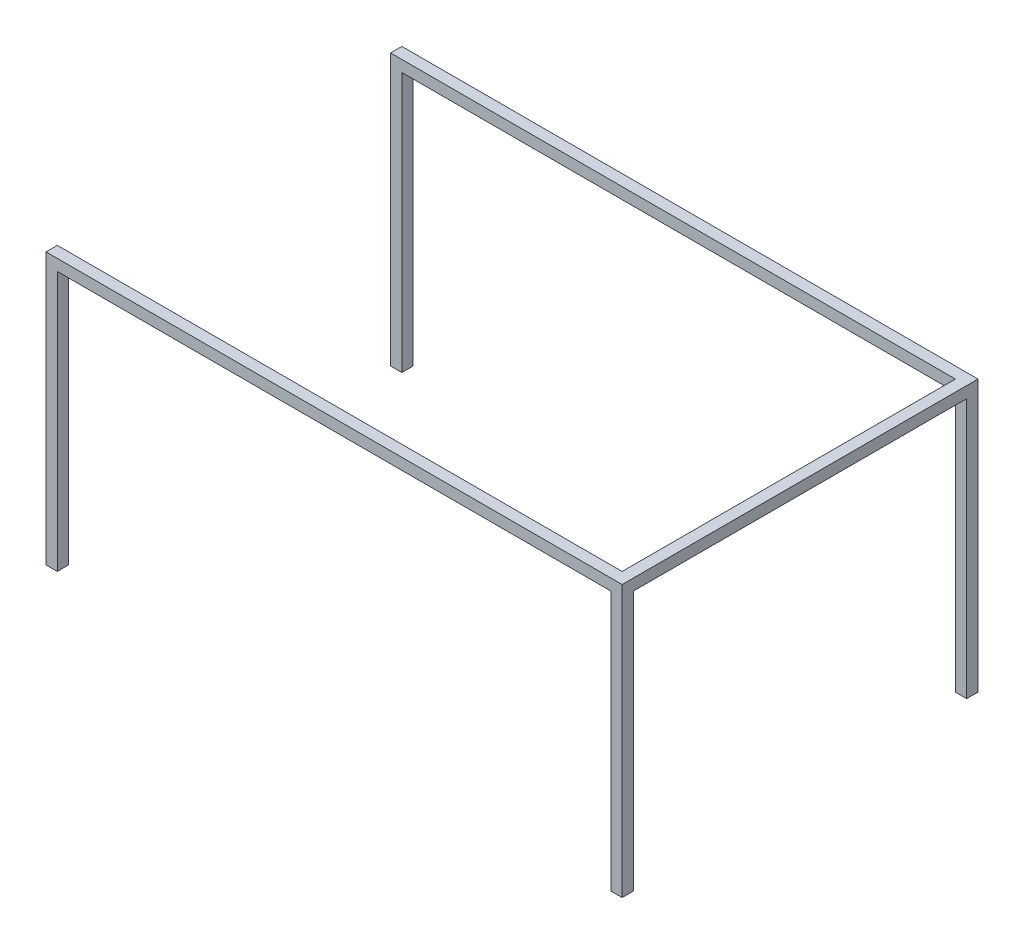
from build123d import *

# Parameters (mm, degrees)
SKETCH1_W           = 1270
SKETCH1_H           = 25.4
BOSS_EXTRUDE1_DEPTH = 25.4
SKETCH2_W           = 25.4
SKETCH2_H           = 25.4
BOSS_EXTRUDE2_DEPTH = 584.2


with BuildPart() as part:
    # Sketch1 → Boss-Extrude1 (new body)
    with BuildSketch(Plane(origin=(0, 0, 0), x_dir=(1, 0, 0), z_dir=(0, 1, 0))):
        with Locations((114.3, -387.35)):
            Rectangle(SKETCH1_W, SKETCH1_H)
        Polygon((749.3, 374.65), (749.3, -374.65), (749.3, -400.05), (774.7, -400.05), (774.7, 400.05), (749.3, 400.05), align=None)
        with Locations((114.3, 387.35)):
            Rectangle(SKETCH1_W, SKETCH1_H)
    extrude(amount=BOSS_EXTRUDE1_DEPTH)

    # Sketch2 → Boss-Extrude2 (add)
    with BuildSketch(Plane(origin=(0, 0, 0), x_dir=(1, 0, 0), z_dir=(0, 1, 0))):
        with Locations((-508, 387.35)):
            Rectangle(SKETCH2_W, SKETCH2_H)
        with Locations((762, 387.35)):
            Rectangle(SKETCH2_W, SKETCH2_H)
        with Locations((762, -387.35)):
            Rectangle(SKETCH2_W, SKETCH2_H)
        with Locations((-508, -387.35)):
            Rectangle(SKETCH2_W, SKETCH2_H)
    extrude(amount=-BOSS_EXTRUDE2_DEPTH)


solid = part.part
